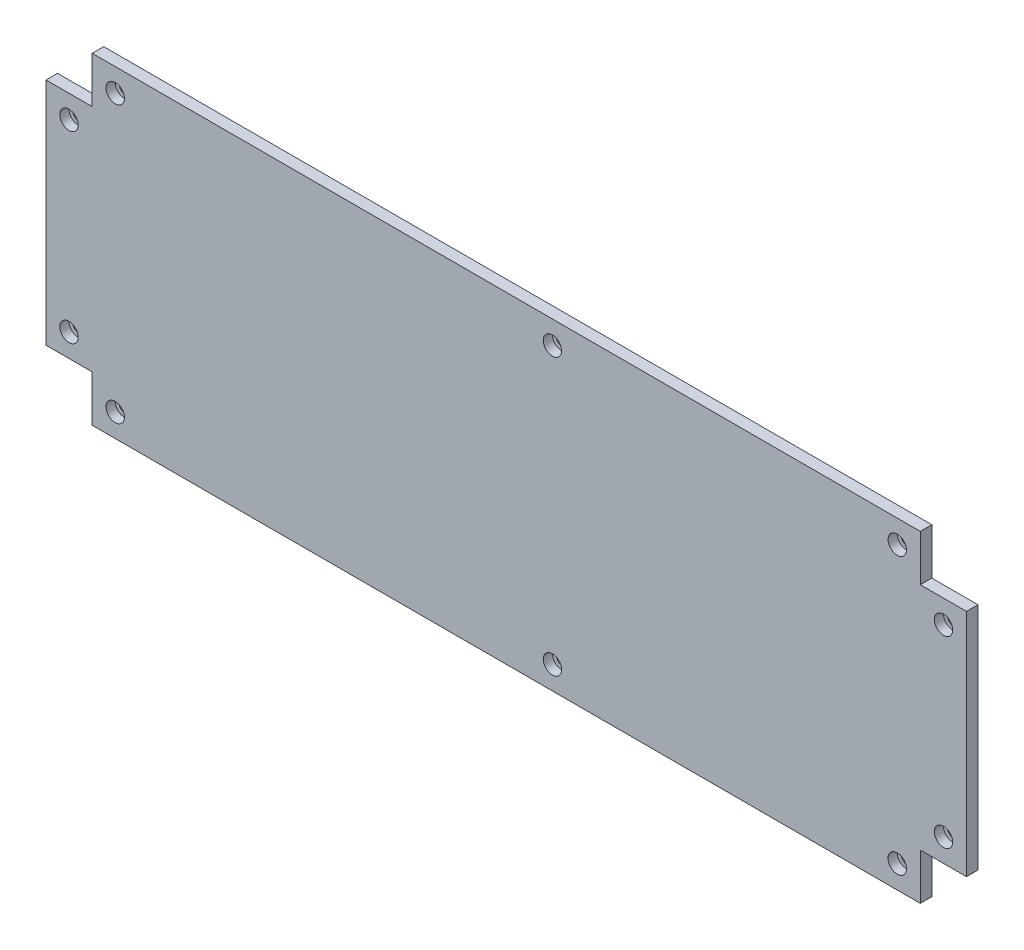
from build123d import *

# Parameters (mm, degrees)
EXTRUDE_1_DEPTH              = 5
HOLE_WIZARD_M4_1_D           = 4.5
HOLE_WIZARD_M4_1_CBORE_D     = 8
HOLE_WIZARD_M4_1_CBORE_DEPTH = 4


with BuildPart() as part:
    # 스케치1 → 보스-돌출1 (new body)
    with BuildSketch(Plane.XY):
        Polygon((-20.08, 0), (0, 0), (0, 20.08), (359.84, 20.08), (359.84, 0), (379.92, 0), (379.92, -99.84), (359.84, -99.84), (359.84, -119.92), (0, -119.92), (0, -99.84), (-20.08, -99.84), align=None)
    extrude(amount=EXTRUDE_1_DEPTH)

    # M4 소켓 머리 캡 나사용 카운터보어1 (through all)
    with Locations(Plane.XY.offset(5)):
        with Locations((-10.08, -10), (-10.08, -89.84), (10, -109.92), (200, -109.92), (349.84, -109.92), (369.92, -89.84), (369.92, -10), (349.84, 10.08), (200, 10.08), (10, 10.08)):
            CounterBoreHole(HOLE_WIZARD_M4_1_D / 2, HOLE_WIZARD_M4_1_CBORE_D / 2, HOLE_WIZARD_M4_1_CBORE_DEPTH)


solid = part.part
